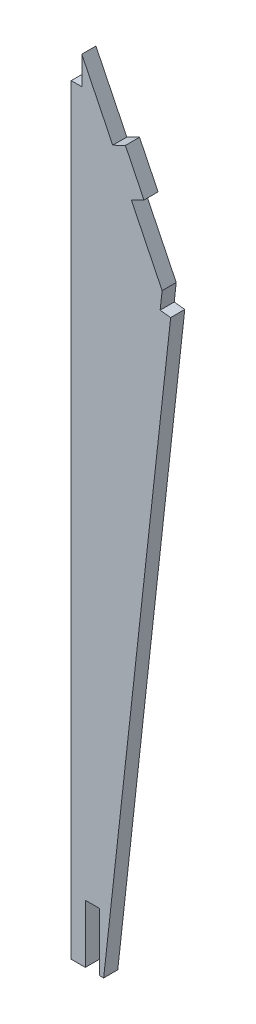
from build123d import *

# Parameters (mm, degrees)
EXTRUDE_1_DEPTH = 2


with BuildPart() as part:
    # 草图1 → 凸台-拉伸1 (new body)
    with BuildSketch(Plane.XY):
        Polygon((26.062349686, 96.108415655), (27.553247454, 95.943419151), (18.054745752, 10.115570425), (17.458609074, 10.115570425), (17.458609074, 18.365570425), (15.458609074, 18.365570425), (15.458609074, 10.115570425), (13.458609074, 10.115570425), (13.458609074, 117.985524546), (14.958609074, 117.985524546), (14.958609074, 121.985524546), (19.342320542, 112.997584083), (21.139908635, 113.874326376), (23.770135515, 108.481562099), (21.972547423, 107.604819805), (26.342973869, 98.644117673), align=None)
    extrude(amount=EXTRUDE_1_DEPTH)


solid = part.part
